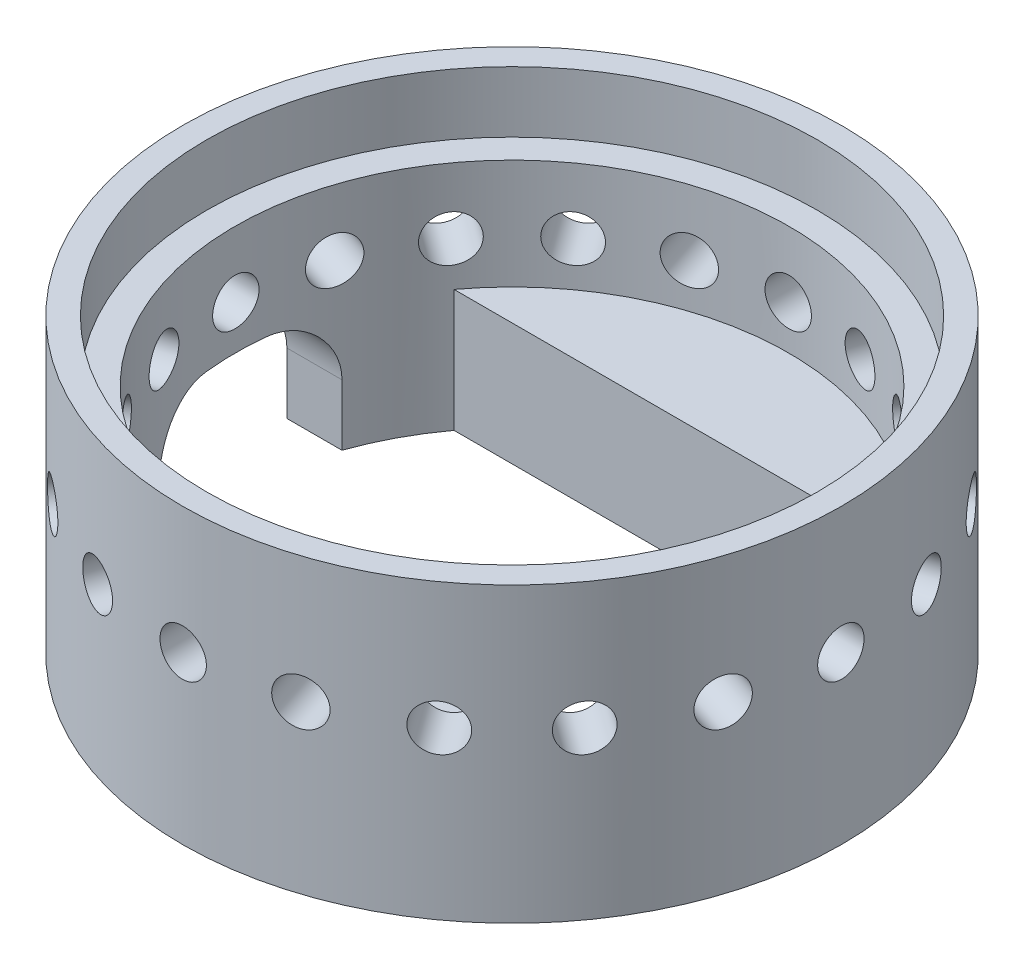
from build123d import *

# Parameters (mm, degrees)
SKETCH1_R               = 27
SKETCH1_R_2             = 22.7
BOSS_EXTRUDE1_DEPTH     = 24
SKETCH2_R               = 25
CUT_EXTRUDE1_DEPTH      = 5
BOSS_EXTRUDE2_DEPTH     = 10
CUT_EXTRUDE2_DEPTH      = 46.099889135
CUT_EXTRUDE3_REACH      = 66.969
CUT_EXTRUDE3_END_RADIUS = 22.7
SKETCH5_R               = 1.9
CIRPATTERN1_COUNT       = 20


with BuildPart() as part:
    # Sketch1 → Boss-Extrude1 (new body)
    with BuildSketch(Plane(origin=(0, 0, 0), x_dir=(1, 0, 0), z_dir=(0, 1, 0))):
        with Locations(Location((0, 0, 0), (0, 0, 270))):
            Circle(SKETCH1_R)
        with Locations(Location((0, 0, 0), (0, 0, 270))):
            Circle(SKETCH1_R_2, mode=Mode.SUBTRACT)
    extrude(amount=BOSS_EXTRUDE1_DEPTH)

    # Sketch2 → Cut-Extrude1 (cut)
    with BuildSketch(Plane(origin=(0, 24, 0), x_dir=(1, 0, 0), z_dir=(0, 1, 0))):
        with Locations(Location((0, 0, 0), (0, 0, 270))):
            Circle(SKETCH2_R)
    extrude(amount=-CUT_EXTRUDE1_DEPTH, mode=Mode.SUBTRACT)

    # Sketch3 → Boss-Extrude2 (add)
    with BuildSketch(Plane.XZ):
        with BuildLine():
            Line((18.249383551, 13.5), (-18.249383551, 13.5))
            ThreePointArc((-18.249383551, 13.5), (0, 22.7), (18.249383551, 13.5))
        make_face()
        with BuildLine():
            Line((18.249383551, -13.5), (-18.249383551, -13.5))
            ThreePointArc((-18.249383551, -13.5), (0, -22.7), (18.249383551, -13.5))
        make_face()
    extrude(amount=-BOSS_EXTRUDE2_DEPTH)

    # Sketch4 → Cut-Extrude2 (cut, through all)
    with BuildSketch(Plane(origin=(0, 0, 0), x_dir=(0, 0, -1), z_dir=(1, 0, 0))):
        with BuildLine():
            Line((7.5, 0), (-7.5, 0))
            Line((-7.5, 0), (-7.5, 5))
            ThreePointArc((-7.5, 5), (-6.035533906, 8.535533906), (-2.5, 10))
            Line((-2.5, 10), (2.5, 10))
            ThreePointArc((2.5, 10), (6.035533906, 8.535533906), (7.5, 5))
            Line((7.5, 5), (7.5, 0))
        make_face()
    extrude(amount=-CUT_EXTRUDE2_DEPTH, mode=Mode.SUBTRACT)

    # Cut-Extrude3: up to this cylinder (the profile starts outside it)
    cut_extrude3_end = Plane(origin=(0, 13.625, 0), z_dir=(0, -1, 0)) * Cylinder(CUT_EXTRUDE3_END_RADIUS, 180.338, mode=Mode.PRIVATE)
    # Sketch5 → Cut-Extrude3 (cut, up to the surface)
    with BuildSketch(Plane.ZY.offset(27), mode=Mode.PRIVATE) as cut_extrude3_sk1:
        with Locations((0, 13.625)):
            Circle(SKETCH5_R)
    cut_extrude3_tool1 = extrude(cut_extrude3_sk1.sketch, amount=-CUT_EXTRUDE3_REACH, mode=Mode.PRIVATE) - cut_extrude3_end
    cut_extrude3 = cut_extrude3_tool1.solids().sort_by_distance((-27, 13.625, 0))[0]
    add(cut_extrude3, mode=Mode.SUBTRACT)

    # CirPattern1: Cut-Extrude3 ×20 about axis
    cirpattern1_axis = Axis((0, 24, 0), (0, 1, 0))
    for i in range(1, CIRPATTERN1_COUNT):
        add(cut_extrude3.rotate(cirpattern1_axis, i * 360 / CIRPATTERN1_COUNT), mode=Mode.SUBTRACT)


solid = part.part
